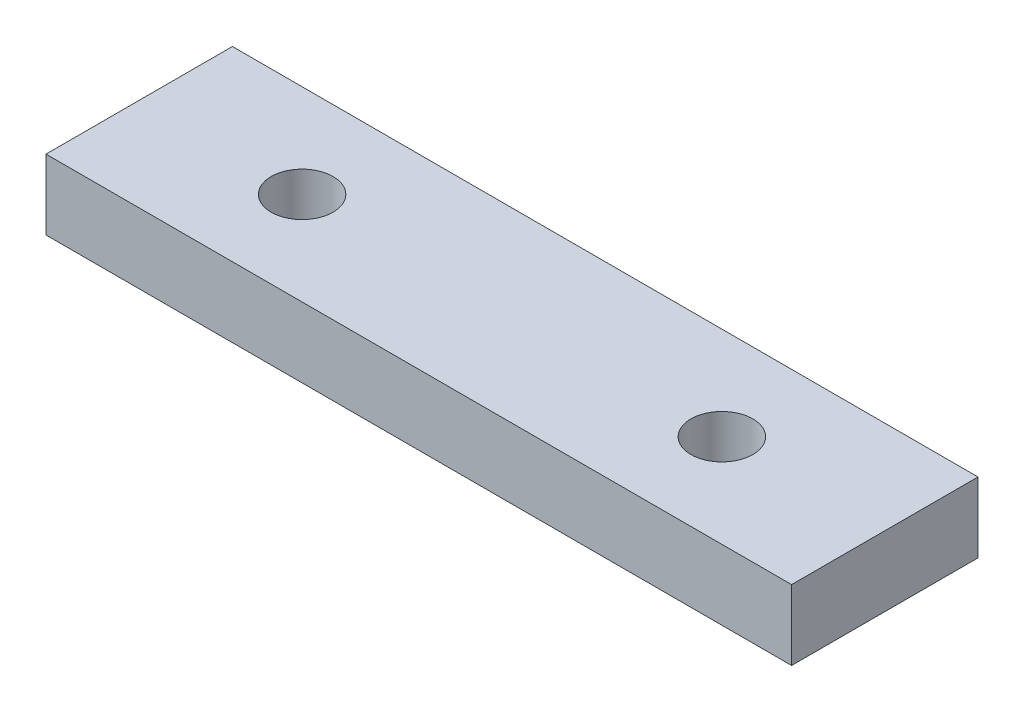
from build123d import *

# Parameters (mm, degrees)
SKETCH1_W           = 50.8
SKETCH1_H           = 12.7
SKETCH1_R           = 2.1082
BOSS_EXTRUDE1_DEPTH = 4.7752


with BuildPart() as part:
    # Sketch1 → Boss-Extrude1 (new body)
    with BuildSketch(Plane(origin=(0, 0, 0), x_dir=(1, 0, 0), z_dir=(0, 1, 0))):
        with Locations((0, 6.35)):
            Rectangle(SKETCH1_W, SKETCH1_H)
        with Locations(Location((14.3002, 6.35, 0), (0, 0, 270))):
            Circle(SKETCH1_R, mode=Mode.SUBTRACT)
        with Locations(Location((-14.3002, 6.35, 0), (0, 0, 270))):
            Circle(SKETCH1_R, mode=Mode.SUBTRACT)
    extrude(amount=BOSS_EXTRUDE1_DEPTH)


solid = part.part
